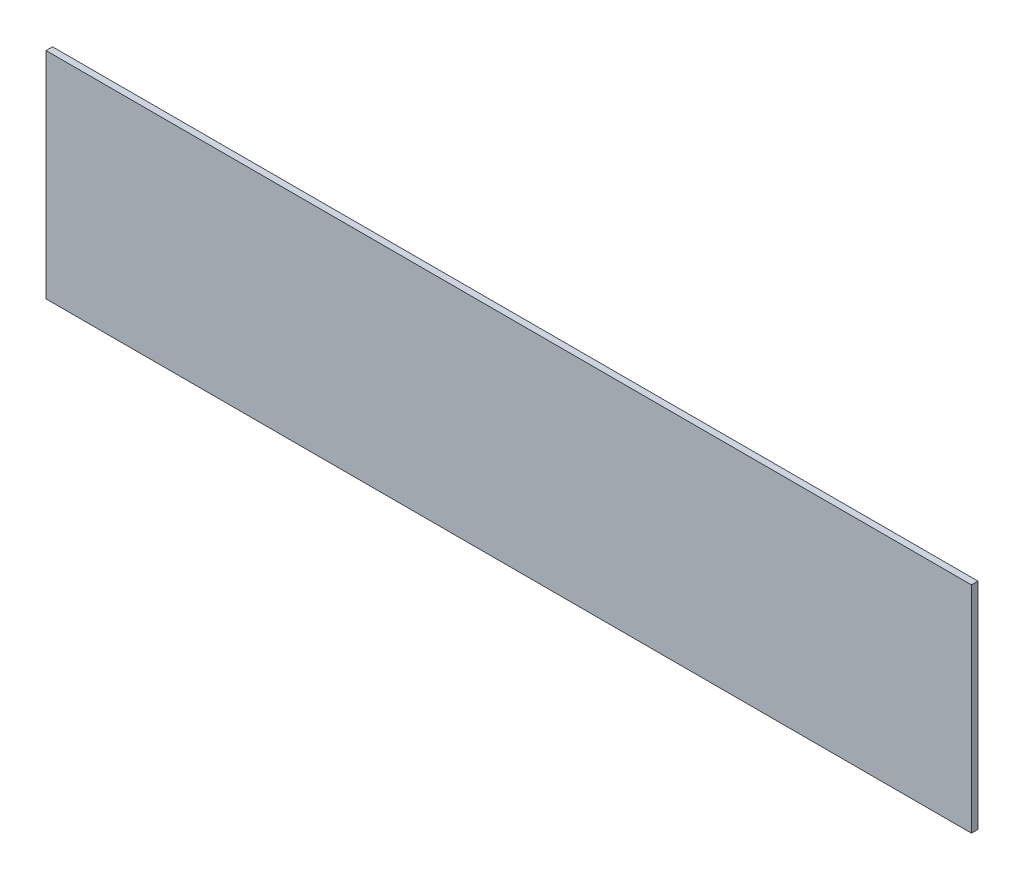
from build123d import *

# Parameters (mm, degrees)
SKETCH_1_W      = 142
SKETCH_1_H      = 33
EXTRUDE_1_DEPTH = 1


with BuildPart() as part:
    # 草图1 → 凸台-拉伸1 (new body)
    with BuildSketch(Plane.XY):
        with Locations((4.138508859, -14.846605332)):
            Rectangle(SKETCH_1_W, SKETCH_1_H)
    extrude(amount=EXTRUDE_1_DEPTH)


solid = part.part
